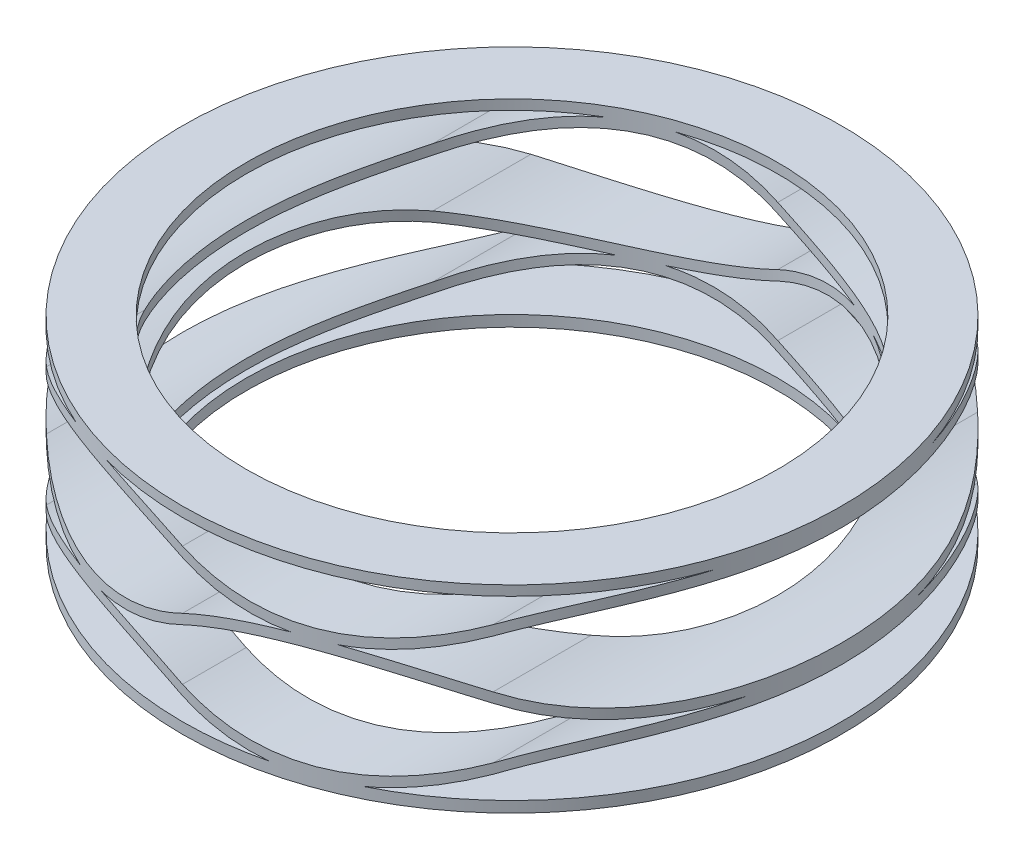
from build123d import *

# Parameters (mm, degrees)
SKETCH1_W           = 30.988
SKETCH1_H           = 30.988
EXTRUDE1_DEPTH      = 0.254
EXTRUDE2_DEPTH      = 9.45134
EXTRUDE2_DEPTH_BACK = 9.45134
EXTRUDE3_DEPTH      = 9.2964
EXTRUDE3_DEPTH_BACK = 9.2964
EXTRUDE4_DEPTH      = 9.2964
EXTRUDE4_DEPTH_BACK = 9.2964
SKETCH5_W           = 30.988
SKETCH5_H           = 30.988
EXTRUDE5_DEPTH      = 0.2286
SKETCH6_W           = 30.988
SKETCH6_H           = 30.988
SKETCH6_R           = 7.62
EXTRUDE6_DEPTH      = 4.572
SKETCH7_R           = 6.1468
EXTRUDE7_DEPTH      = 4.572


with BuildPart() as part:
    # Sketch1 → Extrude1 (new body)
    with BuildSketch(Plane(origin=(0, 0, 0), x_dir=(-1, 0, 0), z_dir=(0, 1, 0))):
        Rectangle(SKETCH1_W, SKETCH1_H)
    extrude(amount=EXTRUDE1_DEPTH)

    # Sketch2 → Extrude2 (add, two sides: drawn at the far end of the back side and taken through both)
    with BuildSketch(Plane.XY.offset(-EXTRUDE2_DEPTH_BACK)):
        with BuildLine():
            Line((10.329333333, 0.7747), (10.329333333, 1.0033))
            ThreePointArc((10.329333333, 1.0033), (7.747, 1.6256), (5.164666667, 1.0033))
            ThreePointArc((5.164666667, 1.0033), (2.582333333, 0.4318), (0, 1.0033))
            ThreePointArc((0, 1.0033), (-2.582333333, 1.6256), (-5.164666667, 1.0033))
            ThreePointArc((-5.164666667, 1.0033), (-7.747, 0.4318), (-10.329333333, 1.0033))
            Line((-10.329333333, 1.0033), (-10.329333333, 0.7747))
            ThreePointArc((-10.329333333, 0.7747), (-7.747, 0.2032), (-5.164666667, 0.7747))
            ThreePointArc((-5.164666667, 0.7747), (-2.582333333, 1.397), (0, 0.7747))
            ThreePointArc((0, 0.7747), (2.582333333, 0.2032), (5.164666667, 0.7747))
            ThreePointArc((5.164666667, 0.7747), (7.747, 1.397), (10.329333333, 0.7747))
        make_face()
    extrude(amount=EXTRUDE2_DEPTH + EXTRUDE2_DEPTH_BACK)

    # Sketch3 → Extrude3 (add, two sides: drawn at the far end of the back side and taken through both)
    with BuildSketch(Plane.XY.offset(-EXTRUDE3_DEPTH_BACK)):
        with BuildLine():
            Line((-10.329333333, 2.4257), (-10.329333333, 2.1971))
            ThreePointArc((-10.329333333, 2.1971), (-7.747, 2.7686), (-5.164666667, 2.1971))
            ThreePointArc((-5.164666667, 2.1971), (-2.582333333, 1.6002), (0, 2.1971))
            ThreePointArc((0, 2.1971), (2.582333333, 2.7686), (5.164666667, 2.1971))
            ThreePointArc((5.164666667, 2.1971), (7.747, 1.6002), (10.329333333, 2.1971))
            Line((10.329333333, 2.1971), (10.329333333, 2.4257))
            ThreePointArc((10.329333333, 2.4257), (7.747, 1.8288), (5.164666667, 2.4257))
            ThreePointArc((5.164666667, 2.4257), (2.582333333, 2.9972), (0, 2.4257))
            ThreePointArc((0, 2.4257), (-2.582333333, 1.8288), (-5.164666667, 2.4257))
            ThreePointArc((-5.164666667, 2.4257), (-7.747, 2.9972), (-10.329333333, 2.4257))
        make_face()
    extrude(amount=EXTRUDE3_DEPTH + EXTRUDE3_DEPTH_BACK)

    # Sketch4 → Extrude4 (add, two sides: drawn at the far end of the back side and taken through both)
    with BuildSketch(Plane.XY.offset(-EXTRUDE4_DEPTH_BACK)):
        with BuildLine():
            Line((10.329333333, 3.5433), (10.329333333, 3.7719))
            ThreePointArc((10.329333333, 3.7719), (7.747, 4.3688), (5.164666667, 3.7719))
            ThreePointArc((5.164666667, 3.7719), (2.582333333, 3.2004), (0, 3.7719))
            ThreePointArc((0, 3.7719), (-2.582333333, 4.3688), (-5.164666667, 3.7719))
            ThreePointArc((-5.164666667, 3.7719), (-7.747, 3.2004), (-10.329333333, 3.7719))
            Line((-10.329333333, 3.7719), (-10.329333333, 3.5433))
            ThreePointArc((-10.329333333, 3.5433), (-7.747, 2.9718), (-5.164666667, 3.5433))
            ThreePointArc((-5.164666667, 3.5433), (-2.582333333, 4.1402), (0, 3.5433))
            ThreePointArc((0, 3.5433), (2.582333333, 2.9718), (5.164666667, 3.5433))
            ThreePointArc((5.164666667, 3.5433), (7.747, 4.1402), (10.329333333, 3.5433))
        make_face()
    extrude(amount=EXTRUDE4_DEPTH + EXTRUDE4_DEPTH_BACK)

    # Sketch5 → Extrude5 (add)
    with BuildSketch(Plane(origin=(0, 4.3434, 0), x_dir=(-1, 0, 0), z_dir=(0, 1, 0))):
        Rectangle(SKETCH5_W, SKETCH5_H)
    extrude(amount=EXTRUDE5_DEPTH)

    # Sketch6 → Extrude6 (cut)
    with BuildSketch(Plane(origin=(0, 0, 0), x_dir=(-1, 0, 0), z_dir=(0, 1, 0))):
        Rectangle(SKETCH6_W, SKETCH6_H)
        with Locations(Location((0, 0, 0), (0, 0, 90))):
            Circle(SKETCH6_R, mode=Mode.SUBTRACT)
    extrude(amount=EXTRUDE6_DEPTH, mode=Mode.SUBTRACT)

    # Sketch7 → Extrude7 (cut)
    with BuildSketch(Plane(origin=(0, 0, 0), x_dir=(-1, 0, 0), z_dir=(0, 1, 0))):
        with Locations(Location((0, 0, 0), (0, 0, 90))):
            Circle(SKETCH7_R)
    extrude(amount=EXTRUDE7_DEPTH, mode=Mode.SUBTRACT)


solid = part.part
